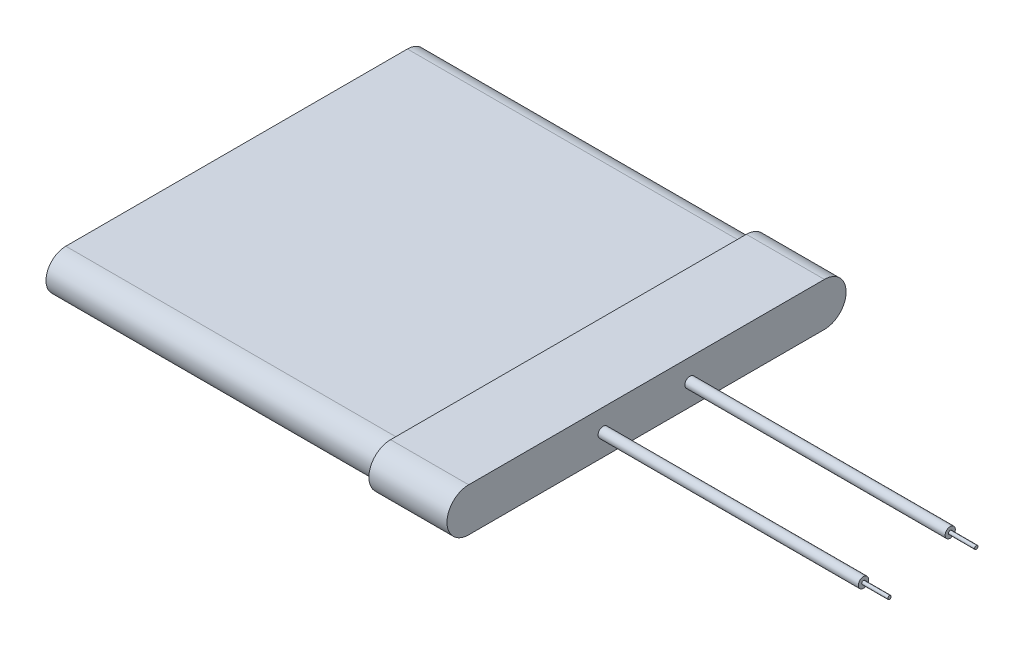
from build123d import *

# Parameters (mm, degrees)
BOSS_EXTRUDE1_DEPTH = 30
SKETCH2_R           = 0.7493
BOSS_EXTRUDE2_DEPTH = 38.1
SKETCH3_R           = 0.254
BOSS_EXTRUDE3_DEPTH = 3.81
SKETCH5_R           = 0.254
BOSS_EXTRUDE4_DEPTH = 3.81
BOSS_EXTRUDE6_DEPTH = 11.43


with BuildPart() as part:
    # Sketch1 → Boss-Extrude1 (new, symmetric)
    with BuildSketch(Plane(origin=(0, 0, 0), x_dir=(0, 0, -1), z_dir=(1, 0, 0))):
        with BuildLine():
            Line((-25, 2.9), (25, 2.9))
            ThreePointArc((25, 2.9), (27.9, 0), (25, -2.9))
            Line((25, -2.9), (-25, -2.9))
            ThreePointArc((-25, -2.9), (-27.9, 0), (-25, 2.9))
        make_face()
    extrude(amount=BOSS_EXTRUDE1_DEPTH, both=True)

    # Sketch2 → Boss-Extrude2 (add)
    with BuildSketch(Plane(origin=(30, 0, 0), x_dir=(0, 0, -1), z_dir=(1, 0, 0))):
        with Locations(Location((-6.35, 0, 0), (0, 0, 180))):
            Circle(SKETCH2_R)
        with Locations(Location((6.35, 0, 0), (0, 0, 180))):
            Circle(SKETCH2_R)
    extrude(amount=BOSS_EXTRUDE2_DEPTH)

    # Sketch3 → Boss-Extrude3 (add)
    with BuildSketch(Plane(origin=(68.1, 0, 0), x_dir=(0, 0, -1), z_dir=(1, 0, 0))):
        with Locations((-6.35, 0)):
            Circle(SKETCH3_R)
    extrude(amount=BOSS_EXTRUDE3_DEPTH)

    # Sketch5 → Boss-Extrude4 (add)
    with BuildSketch(Plane(origin=(68.1, 0, 0), x_dir=(0, 0, -1), z_dir=(1, 0, 0))):
        with Locations((6.35, 0)):
            Circle(SKETCH5_R)
    extrude(amount=BOSS_EXTRUDE4_DEPTH)

    # Sketch6 → Boss-Extrude6 (add)
    with BuildSketch(Plane(origin=(30, 0, 0), x_dir=(0, 0, -1), z_dir=(1, 0, 0))):
        with BuildLine():
            Line((26.035, -3.175), (-26.035, -3.175))
            ThreePointArc((-26.035, -3.175), (-29.21, 0), (-26.035, 3.175))
            Line((-26.035, 3.175), (26.035, 3.175))
            ThreePointArc((26.035, 3.175), (29.21, 0), (26.035, -3.175))
        make_face()
    extrude(amount=-BOSS_EXTRUDE6_DEPTH)


solid = part.part
